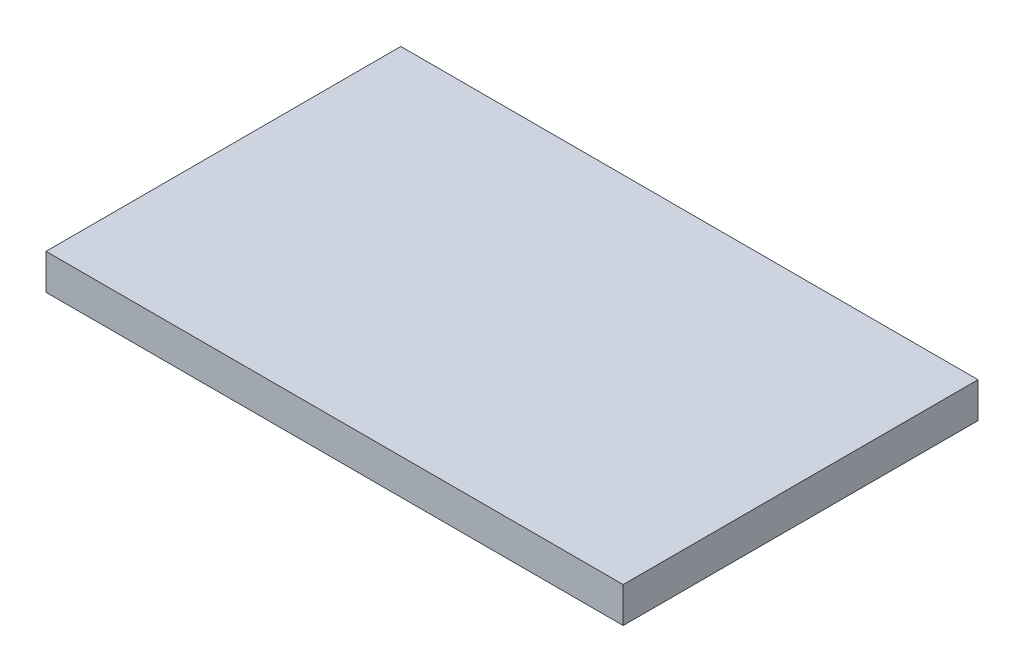
from build123d import *

# Parameters (mm, degrees)
SKETCH1_W           = 244
SKETCH1_H           = 150
BOSS_EXTRUDE1_DEPTH = 15


with BuildPart() as part:
    # Sketch1 → Boss-Extrude1 (new body)
    with BuildSketch(Plane(origin=(0, 0, 0), x_dir=(1, 0, 0), z_dir=(0, 1, 0))):
        Rectangle(SKETCH1_W, SKETCH1_H)
    extrude(amount=BOSS_EXTRUDE1_DEPTH)


solid = part.part
